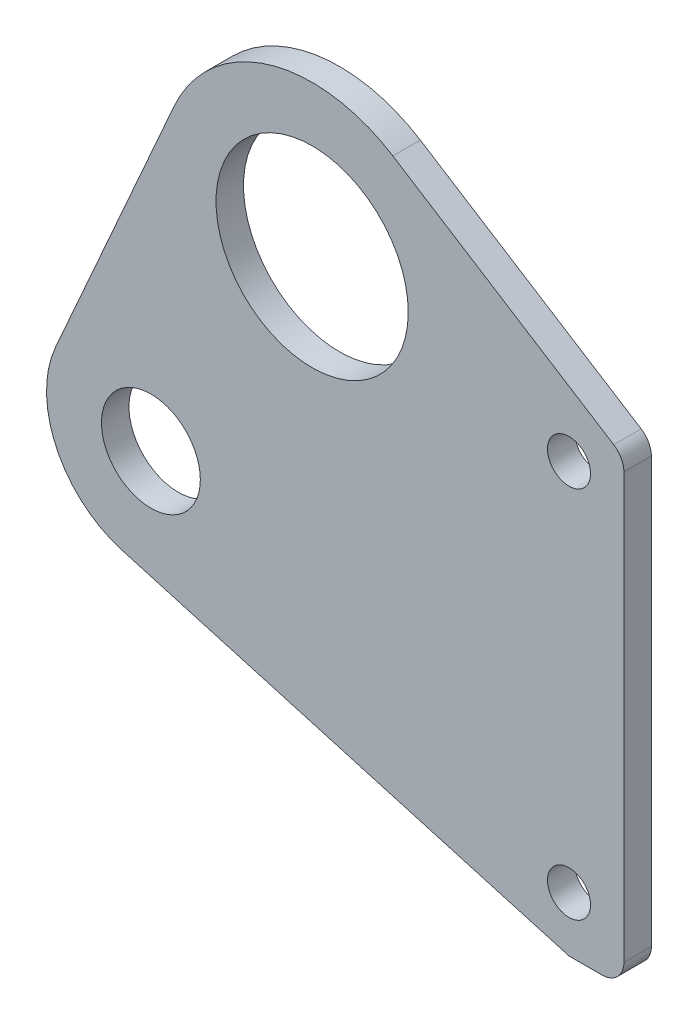
from build123d import *

# Parameters (mm, degrees)
SKETCH1_W                  = 76.2
SKETCH1_H                  = 76.2
BOSS_EXTRUDE1_DEPTH        = 3.175
F_9_0_196_DIAMETER_HOLE1_D = 4.9784
SKETCH4_R                  = 5.715
SKETCH4_R_2                = 11.1125
CUT_EXTRUDE1_DEPTH         = 3.175
CUT_EXTRUDE2_DEPTH         = 3.175
FILLET1_R                  = 2.54


with BuildPart() as part:
    # Sketch1 → Boss-Extrude1 (new body)
    with BuildSketch(Plane(origin=(0, 0, 0), x_dir=(0, 1, 0), z_dir=(0, 0, 1))):
        Rectangle(SKETCH1_W, SKETCH1_H)
    extrude(amount=BOSS_EXTRUDE1_DEPTH)

    # #9 (0.196) Diameter Hole1 (through all)
    with Locations(Plane.XY.offset(3.175)):
        with Locations((31.75, -31.75), (31.75, 11.43)):
            Hole(F_9_0_196_DIAMETER_HOLE1_D / 2)

    # Sketch4 → Cut-Extrude1 (cut)
    with BuildSketch(Plane.XY.offset(3.175)):
        with Locations((-16.587404081, -11.717617647)):
            Circle(SKETCH4_R)
        with Locations((2.053516604, 17.062934398)):
            Circle(SKETCH4_R_2)
    extrude(amount=-CUT_EXTRUDE1_DEPTH, mode=Mode.SUBTRACT)

    # Sketch6 → Cut-Extrude2 (cut)
    with BuildSketch(Plane.XY.offset(3.175)):
        with BuildLine():
            Line((11.387489681, 31.821520131), (38.1, 14.927363968))
            Line((38.1, 14.927363968), (38.1, 38.1))
            Line((38.1, 38.1), (-38.1, 38.1))
            Line((-38.1, 38.1), (-38.1, -38.1))
            Line((-38.1, -38.1), (31.75, -38.1))
            Line((31.75, -38.1), (-19.906877313, -23.316984977))
            ThreePointArc((-19.906877313, -23.316984977), (-27.515067303, -16.831363975), (-27.620065644, -6.834523972))
            Line((-27.620065644, -6.834523972), (-13.914809342, 24.13056998))
            ThreePointArc((-13.914809342, 24.13056998), (-3.025000705, 33.770644241), (11.387489681, 31.821520131))
        make_face()
    extrude(amount=-CUT_EXTRUDE2_DEPTH, mode=Mode.SUBTRACT)

    # Fillet1
    fillet1_edges = [part.edges().sort_by_distance(p)[0] for p in [
        (38.1, 14.927363968, 1.5875),
        (38.1, -38.1, 1.5875),
    ]]
    fillet(fillet1_edges, radius=FILLET1_R)


solid = part.part
